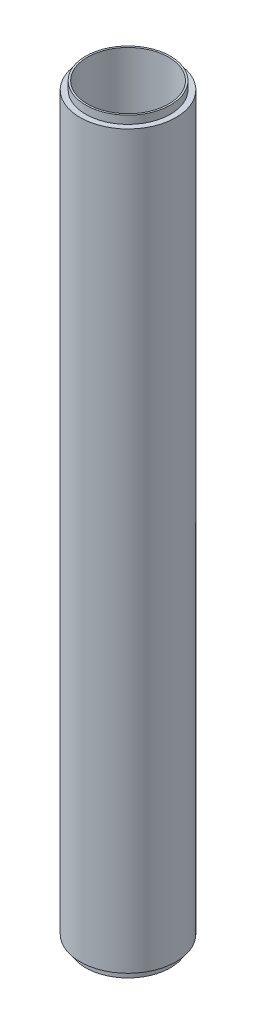
from build123d import *


with BuildPart() as part:
    # Sketch1 → Revolve1 (revolve)
    with BuildSketch(Plane.XY, mode=Mode.PRIVATE) as revolve1_sk:
        Polygon((25.4, -233.6), (25.4, 233.6), (26.5, 233.6), (26.5, 228.6), (30, 228.6), (30, -228.6), (26.5, -228.6), (26.5, -233.6), align=None)
    revolve(revolve1_sk.sketch.rotate(Axis((0, -24.274153908, 0), (0, 1, 0)), 90), axis=Axis((0, -24.274153908, 0), (0, 1, 0)))


solid = part.part
